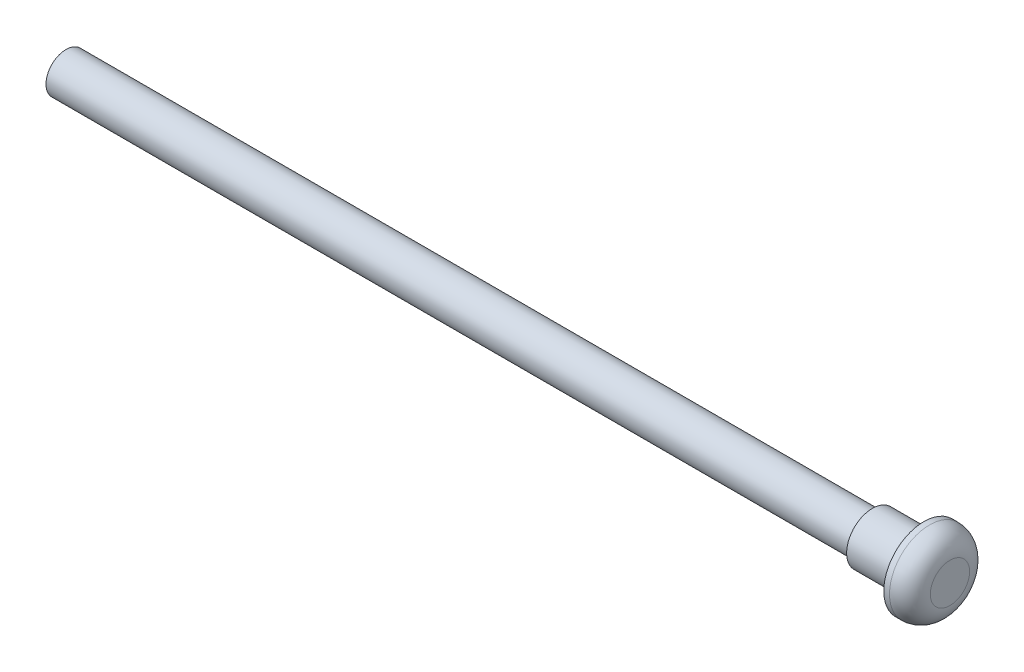
from build123d import *


with BuildPart() as part:
    # Sketch1 → Revolve2 (revolve)
    with BuildSketch(Plane.XY, mode=Mode.PRIVATE) as revolve2_sk:
        with BuildLine():
            Line((0, 0), (152, 0))
            Line((152, 0), (154.571428571, 0))
            Line((154.571428571, 0), (154.571428571, 3.428571429))
            ThreePointArc((154.571428571, 3.428571429), (153.525381361, 5.95395279), (151, 7))
            Line((151, 7), (150, 7))
            Line((150, 7), (150, 4.5))
            Line((150, 4.5), (141, 4.5))
            Line((141, 4.5), (141, 3.5))
            Line((141, 3.5), (0, 3.5))
            Line((0, 3.5), (0, 0))
        make_face()
    revolve(revolve2_sk.sketch.rotate(Axis((0, 0, 0), (1, 0, 0)), 90), axis=Axis((0, 0, 0), (1, 0, 0)))


solid = part.part
